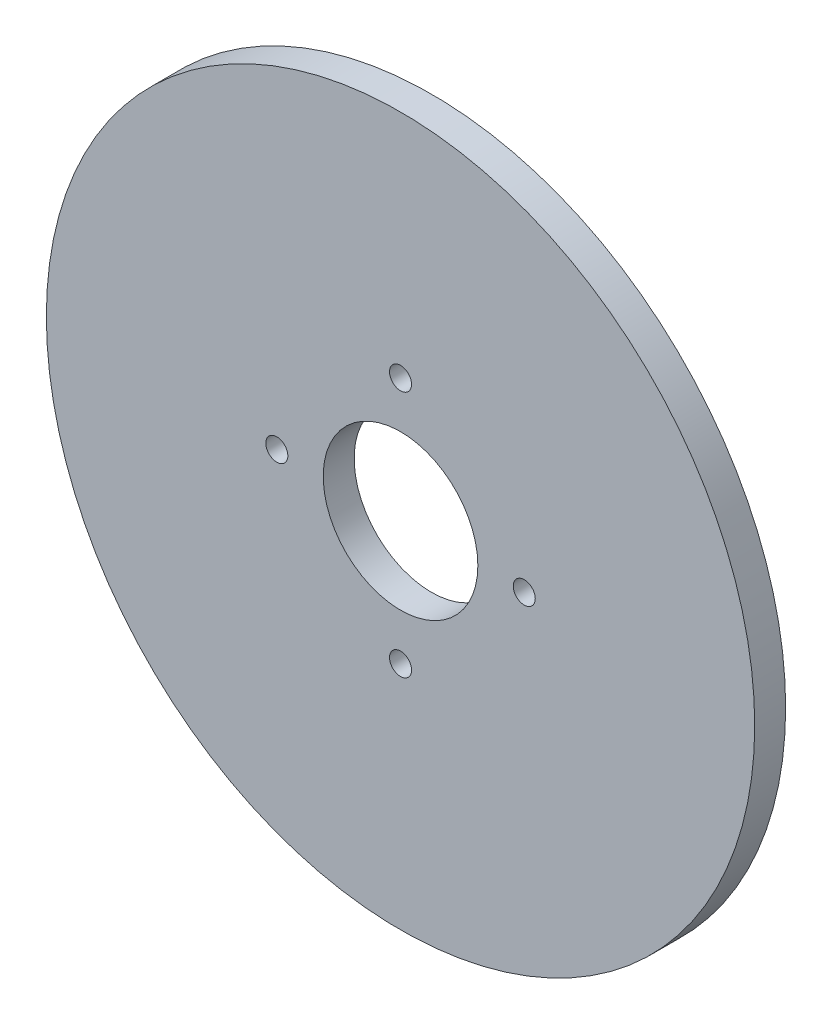
from build123d import *

# Parameters (mm, degrees)
SKETCH1_R                     = 36.3601
SKETCH1_R_2                   = 7.9375
BOSS_EXTRUDE1_DEPTH           = 3.175
TAP_DRILL_FOR_4_40_TAP1_D     = 2.2606
TAP_DRILL_FOR_4_40_TAP1_DEPTH = 4
TAP_DRILL_FOR_4_40_TAP1_TIP   = 0.679152758


with BuildPart() as part:
    # Sketch1 → Boss-Extrude1 (new body)
    with BuildSketch(Plane.XY):
        Circle(SKETCH1_R)
        Circle(SKETCH1_R_2, mode=Mode.SUBTRACT)
    extrude(amount=BOSS_EXTRUDE1_DEPTH)

    # Tap Drill for #4-40 Tap1
    with Locations(Plane.XY.offset(3.175)):
        with Locations((0, 12.7), (0, -12.7), (12.7, 0), (-12.7, 0)):
            Hole(TAP_DRILL_FOR_4_40_TAP1_D / 2, depth=TAP_DRILL_FOR_4_40_TAP1_DEPTH)
            with Locations((0, 0, -(TAP_DRILL_FOR_4_40_TAP1_DEPTH + TAP_DRILL_FOR_4_40_TAP1_TIP / 2))):  # 118° drill point
                Cone(0, TAP_DRILL_FOR_4_40_TAP1_D / 2, TAP_DRILL_FOR_4_40_TAP1_TIP, mode=Mode.SUBTRACT)


solid = part.part
